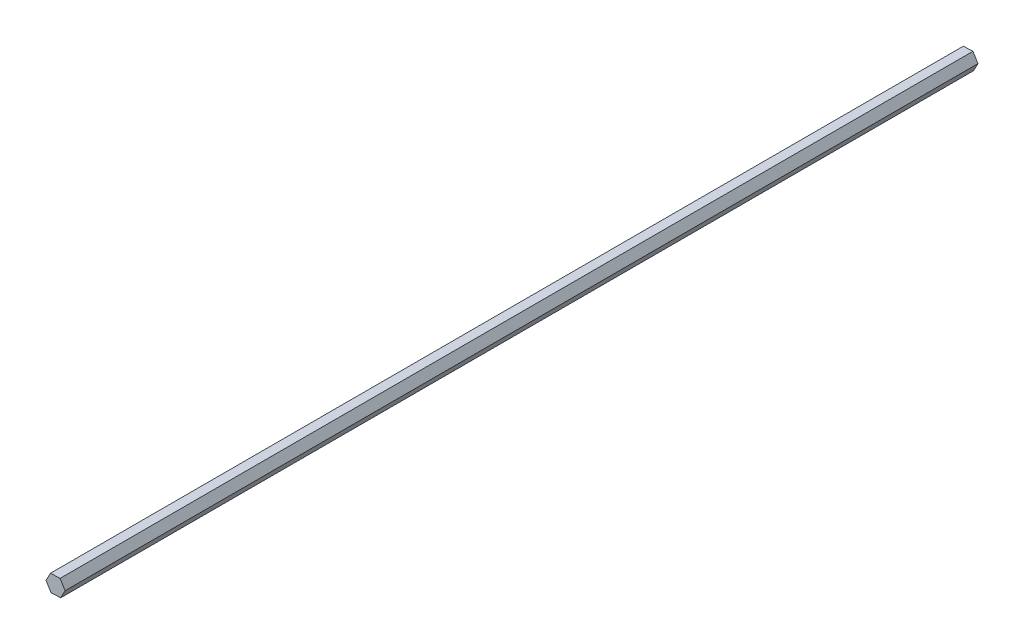
from build123d import *

# Parameters (mm, degrees)
BOSS_EXTRUDE1_DEPTH = 698.5


with BuildPart() as part:
    # Sketch1 → Boss-Extrude1 (new body)
    with BuildSketch(Plane.XY):
        Polygon((3.876081472, -6.224092364), (7.328262839, 0.24473884), (3.452181367, 6.468831204), (-3.876081472, 6.224092364), (-7.328262839, -0.24473884), (-3.452181367, -6.468831204), align=None)
    extrude(amount=BOSS_EXTRUDE1_DEPTH)


solid = part.part
